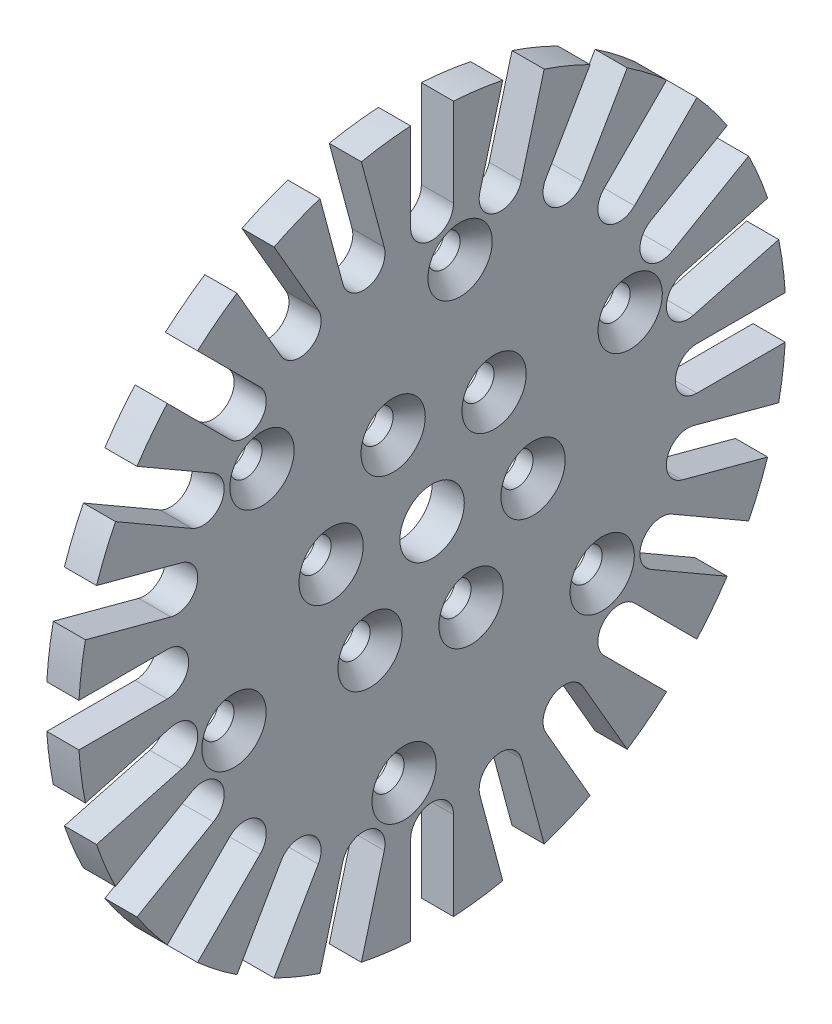
from build123d import *

# Parameters (mm, degrees)
SKETCH1_R                    = 33
BOSS_EXTRUDE1_DEPTH          = 3
CUT_EXTRUDE2_REACH           = 48.765
SKETCH3_R                    = 3.005
CUT_EXTRUDE3_REACH           = 48.765
CIRPATTERN2_COUNT            = 24
CUT_EXTRUDE1_REACH           = 48.68
SKETCH2_R                    = 1.5
CHAMFER1_SIZE                = 1.5
CIRPATTERN1_COUNT            = 6
CHAMFER1_OF_CIRPATTERN1_SIZE = 1.5
CUT_EXTRUDE4_REACH           = 48.68
SKETCH5_R                    = 1.5
CHAMFER2_SIZE                = 1.5
CIRPATTERN3_COUNT            = 6
CHAMFER2_OF_CIRPATTERN3_SIZE = 1.5


with BuildPart() as part:
    # Sketch1 → Boss-Extrude1 (new body)
    with BuildSketch(Plane(origin=(0, 0, 0), x_dir=(0, 0, -1), z_dir=(1, 0, 0))):
        Circle(SKETCH1_R)
    extrude(amount=BOSS_EXTRUDE1_DEPTH)

    # Sketch3 → Cut-Extrude2 (cut, up to next)
    with BuildSketch(Plane(origin=(3, 0, 0), x_dir=(0, 0, -1), z_dir=(1, 0, 0)), mode=Mode.PRIVATE) as cut_extrude2_sk1:
        Circle(SKETCH3_R)
    cut_extrude2_tool1 = extrude(cut_extrude2_sk1.sketch, amount=-CUT_EXTRUDE2_REACH, mode=Mode.PRIVATE) & part.part
    add(cut_extrude2_tool1.solids().sort_by_distance((3, 0, 0))[0], mode=Mode.SUBTRACT)

    # Sketch4 → Cut-Extrude3 (cut, up to next)
    with BuildSketch(Plane(origin=(3, 0, 0), x_dir=(0, 0, -1), z_dir=(1, 0, 0)), mode=Mode.PRIVATE) as cut_extrude3_sk1:
        with BuildLine():
            Line((-2, 33), (-2, 24.7))
            ThreePointArc((-2, 24.7), (0, 22.7), (2, 24.7))
            Line((2, 24.7), (2, 33))
            Line((2, 33), (-2, 33))
        make_face()
    cut_extrude3_tool1 = extrude(cut_extrude3_sk1.sketch, amount=-CUT_EXTRUDE3_REACH, mode=Mode.PRIVATE) & part.part
    cut_extrude3 = cut_extrude3_tool1.solids().sort_by_distance((3, 28.054508, 0))[0]
    add(cut_extrude3, mode=Mode.SUBTRACT)

    # CirPattern2: Cut-Extrude3 ×24 about axis
    cirpattern2_axis = Axis((0, 0, 0), (1, 0, 0))
    for i in range(1, CIRPATTERN2_COUNT):
        add(cut_extrude3.rotate(cirpattern2_axis, i * 360 / CIRPATTERN2_COUNT), mode=Mode.SUBTRACT)

    # Sketch2 → Cut-Extrude1 (cut, up to next)
    with BuildSketch(Plane(origin=(3, 0, 0), x_dir=(0, 0, -1), z_dir=(1, 0, 0)), mode=Mode.PRIVATE) as cut_extrude1_sk1:
        with Locations((2.610523844, 19.828897227)):
            Circle(SKETCH2_R)
    cut_extrude1_tool1 = extrude(cut_extrude1_sk1.sketch, amount=-CUT_EXTRUDE1_REACH, mode=Mode.PRIVATE) & part.part
    cut_extrude1 = cut_extrude1_tool1.solids().sort_by_distance((3, 19.828897, -2.610524))[0]
    add(cut_extrude1, mode=Mode.SUBTRACT)

    # Chamfer1
    chamfer1_edges = [part.edges().sort_by_distance(p)[0] for p in [
        (3, 19.828897227, -1.110523844),
    ]]
    chamfer(chamfer1_edges, length=CHAMFER1_SIZE)

    # CirPattern1: Cut-Extrude1 ×6 about axis
    cirpattern1_axis = Axis((0, 0, 0), (1, 0, 0))
    for i in range(1, CIRPATTERN1_COUNT):
        add(cut_extrude1.rotate(cirpattern1_axis, i * 360 / CIRPATTERN1_COUNT), mode=Mode.SUBTRACT)

    # Chamfer1 of CirPattern1
    chamfer1_of_cirpattern1_edges = [part.edges().sort_by_distance(p)[0] for p in [
        (3, 10.876190474, 16.617066806),
        (3, -8.952706753, 17.72759065),
        (3, -19.828897227, 1.110523844),
        (3, -10.876190474, -16.617066806),
        (3, 8.952706753, -17.72759065),
    ]]
    chamfer(chamfer1_of_cirpattern1_edges, length=CHAMFER1_OF_CIRPATTERN1_SIZE)

    # Sketch5 → Cut-Extrude4 (cut, up to next)
    with BuildSketch(Plane(origin=(3, 0, 0), x_dir=(0, 0, -1), z_dir=(1, 0, 0)), mode=Mode.PRIVATE) as cut_extrude4_sk1:
        with Locations((-3.635492607, 8.776855559)):
            Circle(SKETCH5_R)
    cut_extrude4_tool1 = extrude(cut_extrude4_sk1.sketch, amount=-CUT_EXTRUDE4_REACH, mode=Mode.PRIVATE) & part.part
    cut_extrude4 = cut_extrude4_tool1.solids().sort_by_distance((3, 8.776856, 3.635493))[0]
    add(cut_extrude4, mode=Mode.SUBTRACT)

    # Chamfer2
    chamfer2_edges = [part.edges().sort_by_distance(p)[0] for p in [
        (3, 8.776855559, 5.135492607),
    ]]
    chamfer(chamfer2_edges, length=CHAMFER2_SIZE)

    # CirPattern3: Cut-Extrude4 ×6 about axis
    cirpattern3_axis = Axis((0, 0, 0), (1, 0, 0))
    for i in range(1, CIRPATTERN3_COUNT):
        add(cut_extrude4.rotate(cirpattern3_axis, i * 360 / CIRPATTERN3_COUNT), mode=Mode.SUBTRACT)

    # Chamfer2 of CirPattern3
    chamfer2_of_cirpattern3_edges = [part.edges().sort_by_distance(p)[0] for p in [
        (3, -0.05903928, 10.168726183),
        (3, -8.835894838, 5.033233576),
        (3, -8.776855559, -5.135492607),
        (3, 0.05903928, -10.168726183),
        (3, 8.835894838, -5.033233576),
    ]]
    chamfer(chamfer2_of_cirpattern3_edges, length=CHAMFER2_OF_CIRPATTERN3_SIZE)


solid = part.part
